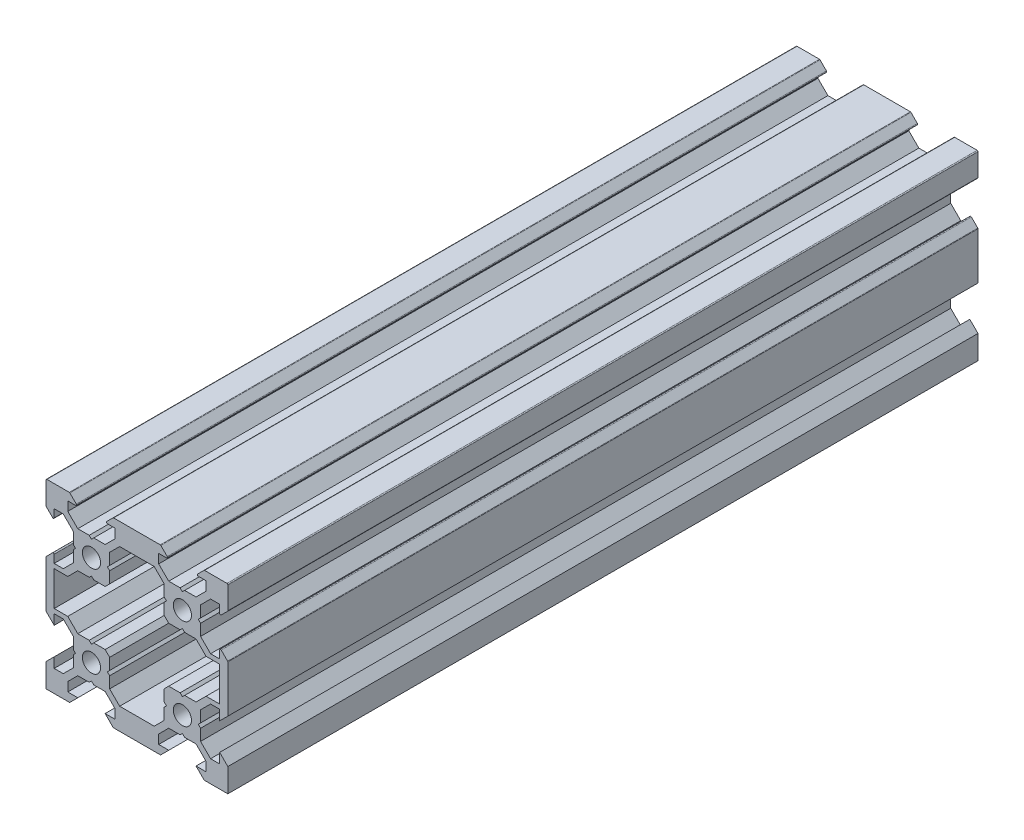
from build123d import *

# Parameters (mm, degrees)
SKETCH2_R           = 2
BOSS_EXTRUDE1_DEPTH = 165


with BuildPart() as part:
    # Sketch2 → Boss-Extrude1 (new body)
    with BuildSketch(Plane.XY):
        with BuildLine():
            Line((-5.245801099, -16.410601136), (-5.245801099, -18.410601136))
            Line((-5.245801099, -18.410601136), (-7.455851605, -18.410601136))
            Line((-7.455851605, -18.410601136), (-5.655851605, -20.210601136))
            Line((-5.655851605, -20.210601136), (4.744148395, -20.210601136))
            Line((4.744148395, -20.210601136), (6.544148395, -18.410601136))
            Line((6.544148395, -18.410601136), (4.334097888, -18.410601136))
            Line((4.334097888, -18.410601136), (4.334097888, -16.410601136))
            Line((4.334097888, -16.410601136), (6.534097888, -14.210601136))
            Line((6.534097888, -14.210601136), (9.044148395, -14.210601136))
            Line((9.044148395, -14.210601136), (9.544148395, -13.710601136))
            Line((9.544148395, -13.710601136), (10.044148395, -14.210601136))
            Line((10.044148395, -14.210601136), (12.554198901, -14.210601136))
            Line((12.554198901, -14.210601136), (14.754198901, -16.410601136))
            Line((14.754198901, -16.410601136), (14.754198901, -18.410601136))
            Line((14.754198901, -18.410601136), (12.544148395, -18.410601136))
            Line((12.544148395, -18.410601136), (14.344148395, -20.210601136))
            Line((14.344148395, -20.210601136), (19.544148395, -20.210601136))
            Line((19.544148395, -20.210601136), (19.544148395, -15.010601136))
            Line((19.544148395, -15.010601136), (17.744148395, -13.210601136))
            Line((17.744148395, -13.210601136), (17.744148395, -15.420651643))
            Line((17.744148395, -15.420651643), (15.744148395, -15.420651643))
            Line((15.744148395, -15.420651643), (13.544148395, -13.220651643))
            Line((13.544148395, -13.220651643), (13.544148395, -10.710601136))
            Line((13.544148395, -10.710601136), (13.044148395, -10.210601136))
            Line((13.044148395, -10.210601136), (13.544148395, -9.710601136))
            Line((13.544148395, -9.710601136), (13.544148395, -7.20055063))
            Line((13.544148395, -7.20055063), (15.744148395, -5.00055063))
            Line((15.744148395, -5.00055063), (17.744148395, -5.00055063))
            Line((17.744148395, -5.00055063), (17.744148395, -7.210601136))
            Line((17.744148395, -7.210601136), (19.544148395, -5.410601136))
            Line((19.544148395, -5.410601136), (19.544148395, 4.906556151))
            ThreePointArc((19.544148395, 4.906556151), (19.528924301, 4.983092838), (19.485569751, 5.047977508))
            Line((19.485569751, 5.047977508), (18.085569751, 6.447977508))
            ThreePointArc((18.085569751, 6.447977508), (17.867611708, 6.491332058), (17.744148395, 6.306556151))
            Line((17.744148395, 6.306556151), (17.744148395, 4.579348357))
            Line((17.744148395, 4.579348357), (15.744148395, 4.579348357))
            Line((15.744148395, 4.579348357), (13.544148395, 6.779348357))
            Line((13.544148395, 6.779348357), (13.544148395, 9.289398864))
            Line((13.544148395, 9.289398864), (13.044148395, 9.789398864))
            Line((13.044148395, 9.789398864), (13.544148395, 10.289398864))
            Line((13.544148395, 10.289398864), (13.544148395, 12.79944937))
            Line((13.544148395, 12.79944937), (15.744148395, 14.99944937))
            Line((15.744148395, 14.99944937), (17.744148395, 14.99944937))
            Line((17.744148395, 14.99944937), (17.744148395, 13.272241576))
            ThreePointArc((17.744148395, 13.272241576), (17.867611708, 13.08746567), (18.085569751, 13.13082022))
            Line((18.085569751, 13.13082022), (19.485569751, 14.53082022))
            ThreePointArc((19.485569751, 14.53082022), (19.528924301, 14.59570489), (19.544148395, 14.672241576))
            Line((19.544148395, 14.672241576), (19.544148395, 19.589398864))
            ThreePointArc((19.544148395, 19.589398864), (19.485569751, 19.73082022), (19.344148395, 19.789398864))
            Line((19.344148395, 19.789398864), (14.426991107, 19.789398864))
            ThreePointArc((14.426991107, 19.789398864), (14.350454421, 19.77417477), (14.285569751, 19.73082022))
            Line((14.285569751, 19.73082022), (12.885569751, 18.33082022))
            ThreePointArc((12.885569751, 18.33082022), (12.842215201, 18.112862177), (13.026991107, 17.989398864))
            Line((13.026991107, 17.989398864), (14.754198901, 17.989398864))
            Line((14.754198901, 17.989398864), (14.754198901, 15.989398864))
            Line((14.754198901, 15.989398864), (12.554198901, 13.789398864))
            Line((12.554198901, 13.789398864), (10.044148395, 13.789398864))
            Line((10.044148395, 13.789398864), (9.544148395, 13.289398864))
            Line((9.544148395, 13.289398864), (9.044148395, 13.789398864))
            Line((9.044148395, 13.789398864), (6.534097888, 13.789398864))
            Line((6.534097888, 13.789398864), (4.334097888, 15.989398864))
            Line((4.334097888, 15.989398864), (4.334097888, 17.989398864))
            Line((4.334097888, 17.989398864), (6.061305682, 17.989398864))
            ThreePointArc((6.061305682, 17.989398864), (6.246081589, 18.112862177), (6.202727038, 18.33082022))
            Line((6.202727038, 18.33082022), (4.802727038, 19.73082022))
            ThreePointArc((4.802727038, 19.73082022), (4.737842369, 19.77417477), (4.661305682, 19.789398864))
            Line((4.661305682, 19.789398864), (-5.573008893, 19.789398864))
            ThreePointArc((-5.573008893, 19.789398864), (-5.649545579, 19.77417477), (-5.714430249, 19.73082022))
            Line((-5.714430249, 19.73082022), (-7.114430249, 18.33082022))
            ThreePointArc((-7.114430249, 18.33082022), (-7.157784799, 18.112862177), (-6.973008893, 17.989398864))
            Line((-6.973008893, 17.989398864), (-5.245801099, 17.989398864))
            Line((-5.245801099, 17.989398864), (-5.245801099, 15.989398864))
            Line((-5.245801099, 15.989398864), (-7.445801099, 13.789398864))
            Line((-7.445801099, 13.789398864), (-9.955851605, 13.789398864))
            Line((-9.955851605, 13.789398864), (-10.455851605, 13.289398864))
            Line((-10.455851605, 13.289398864), (-10.955851605, 13.789398864))
            Line((-10.955851605, 13.789398864), (-13.465902112, 13.789398864))
            Line((-13.465902112, 13.789398864), (-15.665902112, 15.989398864))
            Line((-15.665902112, 15.989398864), (-15.665902112, 17.989398864))
            Line((-15.665902112, 17.989398864), (-13.938694318, 17.989398864))
            ThreePointArc((-13.938694318, 17.989398864), (-13.753918411, 18.112862177), (-13.797272962, 18.33082022))
            Line((-13.797272962, 18.33082022), (-15.197272962, 19.73082022))
            ThreePointArc((-15.197272962, 19.73082022), (-15.262157631, 19.77417477), (-15.338694318, 19.789398864))
            Line((-15.338694318, 19.789398864), (-20.255851605, 19.789398864))
            ThreePointArc((-20.255851605, 19.789398864), (-20.397272962, 19.73082022), (-20.455851605, 19.589398864))
            Line((-20.455851605, 19.589398864), (-20.455851605, 14.672241576))
            ThreePointArc((-20.455851605, 14.672241576), (-20.440627512, 14.59570489), (-20.397272962, 14.53082022))
            Line((-20.397272962, 14.53082022), (-18.997272962, 13.13082022))
            ThreePointArc((-18.997272962, 13.13082022), (-18.779314919, 13.08746567), (-18.655851605, 13.272241576))
            Line((-18.655851605, 13.272241576), (-18.655851605, 14.99944937))
            Line((-18.655851605, 14.99944937), (-16.655851605, 14.99944937))
            Line((-16.655851605, 14.99944937), (-14.455851605, 12.79944937))
            Line((-14.455851605, 12.79944937), (-14.455851605, 10.289398864))
            Line((-14.455851605, 10.289398864), (-13.955851605, 9.789398864))
            Line((-13.955851605, 9.789398864), (-14.455851605, 9.289398864))
            Line((-14.455851605, 9.289398864), (-14.455851605, 6.779348357))
            Line((-14.455851605, 6.779348357), (-16.655851605, 4.579348357))
            Line((-16.655851605, 4.579348357), (-18.655851605, 4.579348357))
            Line((-18.655851605, 4.579348357), (-18.655851605, 6.306556151))
            ThreePointArc((-18.655851605, 6.306556151), (-18.779314919, 6.491332058), (-18.997272962, 6.447977508))
            Line((-18.997272962, 6.447977508), (-20.397272962, 5.047977508))
            ThreePointArc((-20.397272962, 5.047977508), (-20.440627512, 4.983092838), (-20.455851605, 4.906556151))
            Line((-20.455851605, 4.906556151), (-20.455851605, -5.410601136))
            Line((-20.455851605, -5.410601136), (-18.655851605, -7.210601136))
            Line((-18.655851605, -7.210601136), (-18.655851605, -5.00055063))
            Line((-18.655851605, -5.00055063), (-16.655851605, -5.00055063))
            Line((-16.655851605, -5.00055063), (-14.455851605, -7.20055063))
            Line((-14.455851605, -7.20055063), (-14.455851605, -9.710601136))
            Line((-14.455851605, -9.710601136), (-13.955851605, -10.210601136))
            Line((-13.955851605, -10.210601136), (-14.455851605, -10.710601136))
            Line((-14.455851605, -10.710601136), (-14.455851605, -13.220651643))
            Line((-14.455851605, -13.220651643), (-16.655851605, -15.420651643))
            Line((-16.655851605, -15.420651643), (-18.655851605, -15.420651643))
            Line((-18.655851605, -15.420651643), (-18.655851605, -13.210601136))
            Line((-18.655851605, -13.210601136), (-20.455851605, -15.010601136))
            Line((-20.455851605, -15.010601136), (-20.455851605, -20.210601136))
            Line((-20.455851605, -20.210601136), (-15.255851605, -20.210601136))
            Line((-15.255851605, -20.210601136), (-13.455851605, -18.410601136))
            Line((-13.455851605, -18.410601136), (-15.665902112, -18.410601136))
            Line((-15.665902112, -18.410601136), (-15.665902112, -16.410601136))
            Line((-15.665902112, -16.410601136), (-13.465902112, -14.210601136))
            Line((-13.465902112, -14.210601136), (-10.955851605, -14.210601136))
            Line((-10.955851605, -14.210601136), (-10.455851605, -13.710601136))
            Line((-10.455851605, -13.710601136), (-9.955851605, -14.210601136))
            Line((-9.955851605, -14.210601136), (-7.445801099, -14.210601136))
            Line((-7.445801099, -14.210601136), (-5.245801099, -16.410601136))
        make_face()
        with Locations((-10.455851605, 9.789398864)):
            Circle(SKETCH2_R, mode=Mode.SUBTRACT)
        with Locations((9.544148395, 9.789398864)):
            Circle(SKETCH2_R, mode=Mode.SUBTRACT)
        with Locations((-10.455851605, -10.210601136)):
            Circle(SKETCH2_R, mode=Mode.SUBTRACT)
        with Locations((9.544148395, -10.210601136)):
            Circle(SKETCH2_R, mode=Mode.SUBTRACT)
        Polygon((-6.455851605, 12.79944937), (-4.255851605, 14.99944937), (3.344148395, 14.99944937), (5.544148395, 12.79944937), (5.544148395, 10.289398864), (6.044148395, 9.789398864), (5.544148395, 9.289398864), (5.544148395, 6.779348357), (6.534097888, 5.789398864), (9.044148395, 5.789398864), (9.544148395, 6.289398864), (10.044148395, 5.789398864), (12.554198901, 5.789398864), (14.754198901, 3.589398864), (17.744148395, 3.589398864), (17.744148395, -4.010601136), (14.754198901, -4.010601136), (12.554198901, -6.210601136), (10.044148395, -6.210601136), (9.544148395, -6.710601136), (9.044148395, -6.210601136), (6.534097888, -6.210601136), (5.544148395, -7.20055063), (5.544148395, -9.710601136), (6.044148395, -10.210601136), (5.544148395, -10.710601136), (5.544148395, -13.220651643), (3.344148395, -15.420651643), (-4.255851605, -15.420651643), (-6.455851605, -13.220651643), (-6.455851605, -10.710601136), (-6.955851605, -10.210601136), (-6.455851605, -9.710601136), (-6.455851605, -7.20055063), (-7.445801099, -6.210601136), (-9.955851605, -6.210601136), (-10.455851605, -6.710601136), (-10.955851605, -6.210601136), (-13.465902112, -6.210601136), (-15.665902112, -4.010601136), (-18.655851605, -4.010601136), (-18.655851605, 3.589398864), (-15.665902112, 3.589398864), (-13.465902112, 5.789398864), (-10.955851605, 5.789398864), (-10.455851605, 6.289398864), (-9.955851605, 5.789398864), (-7.445801099, 5.789398864), (-6.455851605, 6.779348357), (-6.455851605, 9.289398864), (-6.955851605, 9.789398864), (-6.455851605, 10.289398864), align=None, mode=Mode.SUBTRACT)
    extrude(amount=-BOSS_EXTRUDE1_DEPTH)


solid = part.part
